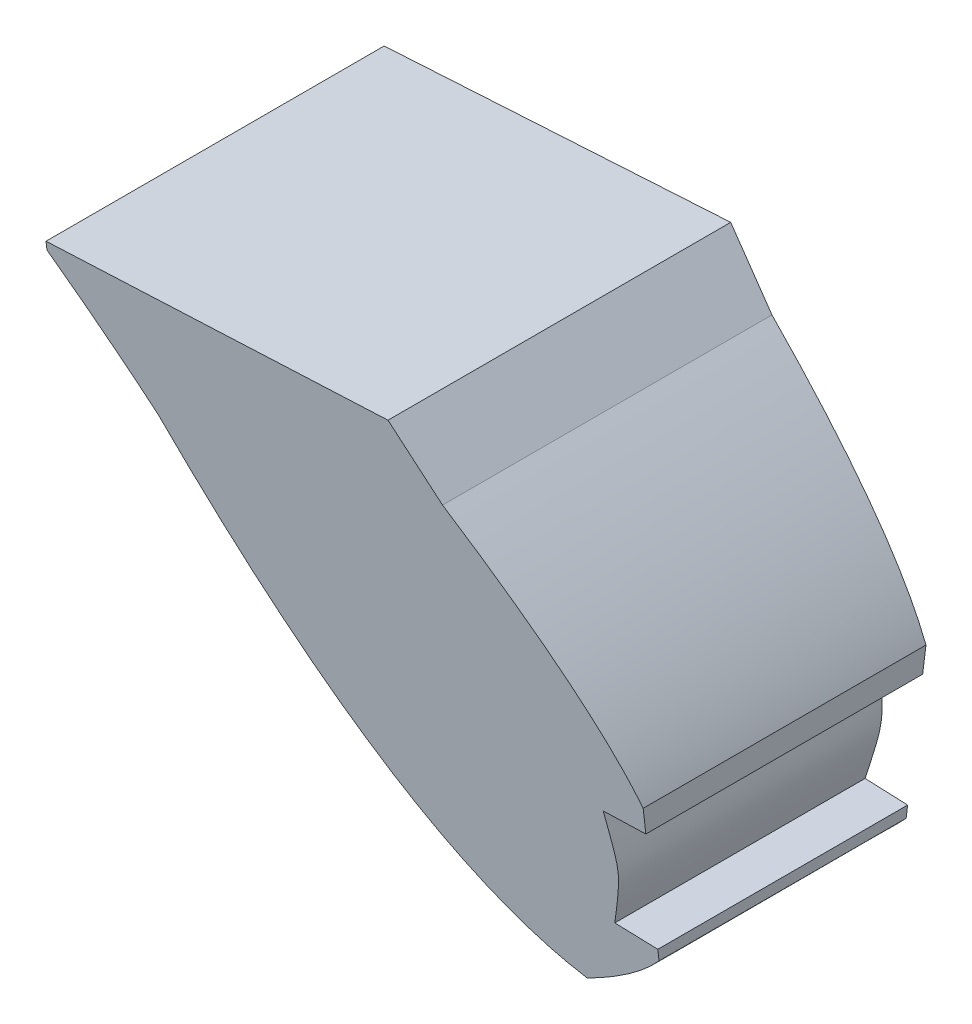
from build123d import *

# Parameters (mm, degrees)
SALIENTE_EXTRUIR1_DEPTH      = 7
SALIENTE_EXTRUIR2_DEPTH      = 7
SALIENTE_EXTRUIR2_DEPTH_BACK = 7
CORTAR_EXTRUIR2_DEPTH        = 28.177550449
CORTAR_EXTRUIR2_DEPTH_BACK   = 28.177550449


with BuildPart() as part:
    # Croquis1 → Saliente-Extruir1 (new, symmetric)
    with BuildSketch(Plane.XY):
        with BuildLine():
            add(Edge.make_bspline(
                [(-18.945192114, 7.540918896), (-10.215008384, -3.697644103), (-2.846604825, -5.059081104)],
                knots=[0.497667241, 0.497667241, 0.497667241, 0.49955428, 0.49955428, 0.49955428], degree=2, weights=[1, 1, 1]))
            add(Edge.make_bspline(
                [(-2.846604825, -5.059081104), (-0.742366882, -3.9352066), (0.355125, -2.723253227)],
                knots=[0.498812075, 0.498812075, 0.498812075, 0.499412845, 0.499412845, 0.499412845], degree=2, weights=[1, 1, 1]))
            Line((0.355125, -2.723253227), (0.355125, -2.284841781))
            Line((0.355125, -2.284841781), (-1.394875, -2.223730435))
            add(Edge.make_bspline(
                [(-1.394875, -2.223730435), (-0.90753067, -0.123730435), (-1.394875, 1.976269565)],
                knots=[0, 0, 0, 1, 1, 1], degree=2, weights=[1, 3.231801219, 1]))
            Line((-1.394875, 1.976269565), (0.355125, 2.284841781))
            Line((0.355125, 2.284841781), (0.355125, 3.001549529))
            add(Edge.make_bspline(
                [(0.355125, 3.001549529), (-1.44872627, 6.058427314), (-6.994875026, 10.477389992)],
                knots=[0.500820705, 0.500820705, 0.500820705, 0.502013312, 0.502013312, 0.502013312], degree=2, weights=[1, 1, 1]))
            Line((-6.994875026, 10.477389992), (-8.981845695, 12.608155172))
            Line((-8.981845695, 12.608155172), (-23.035921146, 11.871612288))
            Line((-23.035921146, 11.871612288), (-23.035921146, 11.54013782))
            ThreePointArc((-23.035921146, 11.54013782), (-20.949684518, 9.582335705), (-18.945192114, 7.540918896))
        make_face()
    extrude(amount=SALIENTE_EXTRUIR1_DEPTH, both=True)

    # Croquis4 → Saliente-Extruir2 (add, two sides: drawn at the far end of the back side and taken through both)
    with BuildSketch(Plane.XY.offset(-SALIENTE_EXTRUIR2_DEPTH_BACK)):
        Polygon((-1.394875, 1.976269565), (0.355125, 2.284841781), (0.355125, 2.037380912), align=None)
    extrude(amount=SALIENTE_EXTRUIR2_DEPTH + SALIENTE_EXTRUIR2_DEPTH_BACK)

    # Croquis6 → Cortar-Extruir2 (cut, two sides: drawn at the far end of the back side and taken through both)
    with BuildSketch(Plane(origin=(0, 0, 0), x_dir=(0, 0, -1), z_dir=(1, 0, 0)).offset(-CORTAR_EXTRUIR2_DEPTH_BACK)):
        Polygon((7, 12.608155172), (7, -5.059081104), (4.5, -5.059081104), align=None)
        Polygon((-7, 12.608155172), (-7, -5.059081104), (-5, -5.059081104), align=None)
    extrude(amount=CORTAR_EXTRUIR2_DEPTH + CORTAR_EXTRUIR2_DEPTH_BACK, mode=Mode.SUBTRACT)


solid = part.part
